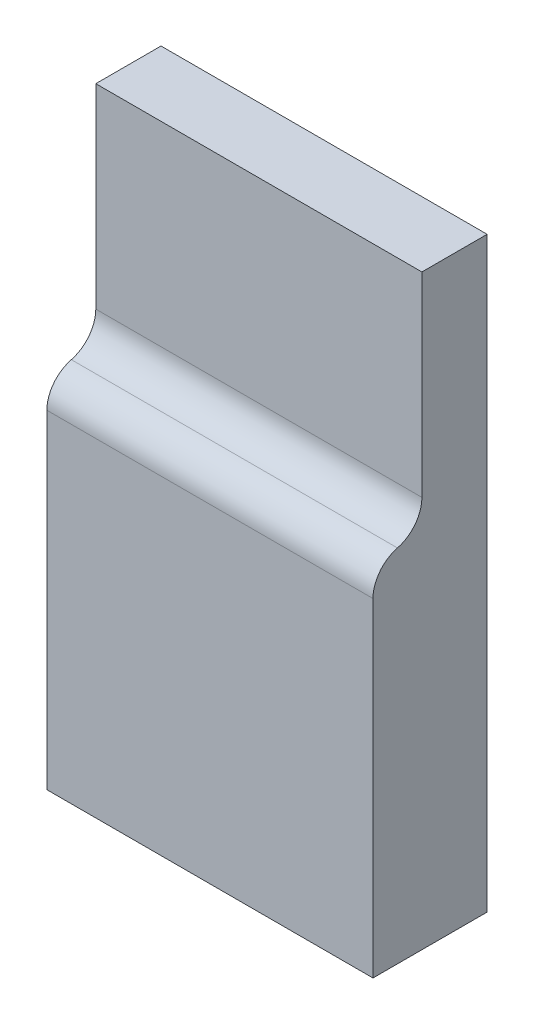
from build123d import *

# Parameters (mm, degrees)
SKETCH_1_W      = 100
SKETCH_1_H      = 180
EXTRUDE_1_DEPTH = 20
SKETCH_2_W      = 100
SKETCH_2_H      = 110.772585851
EXTRUDE_2_DEPTH = 15
FILLET_1_R      = 10
FILLET_2_R      = 10


with BuildPart() as part:
    # 草图1 → 凸台-拉伸1 (new body)
    with BuildSketch(Plane.XY):
        Rectangle(SKETCH_1_W, SKETCH_1_H)
    extrude(amount=EXTRUDE_1_DEPTH)

    # 草图2 → 凸台-拉伸2 (add)
    with BuildSketch(Plane.XY.offset(20)):
        with Locations((0, -34.613707074)):
            Rectangle(SKETCH_2_W, SKETCH_2_H)
    extrude(amount=EXTRUDE_2_DEPTH)

    # 圆角1
    fillet_1_edges = [part.edges().sort_by_distance(p)[0] for p in [
        (0, 20.772585851, 35),
    ]]
    fillet(fillet_1_edges, radius=FILLET_1_R)

    # 圆角2
    fillet_2_edges = [part.edges().sort_by_distance(p)[0] for p in [
        (0, 20.772585851, 20),
    ]]
    fillet(fillet_2_edges, radius=FILLET_2_R)


solid = part.part
